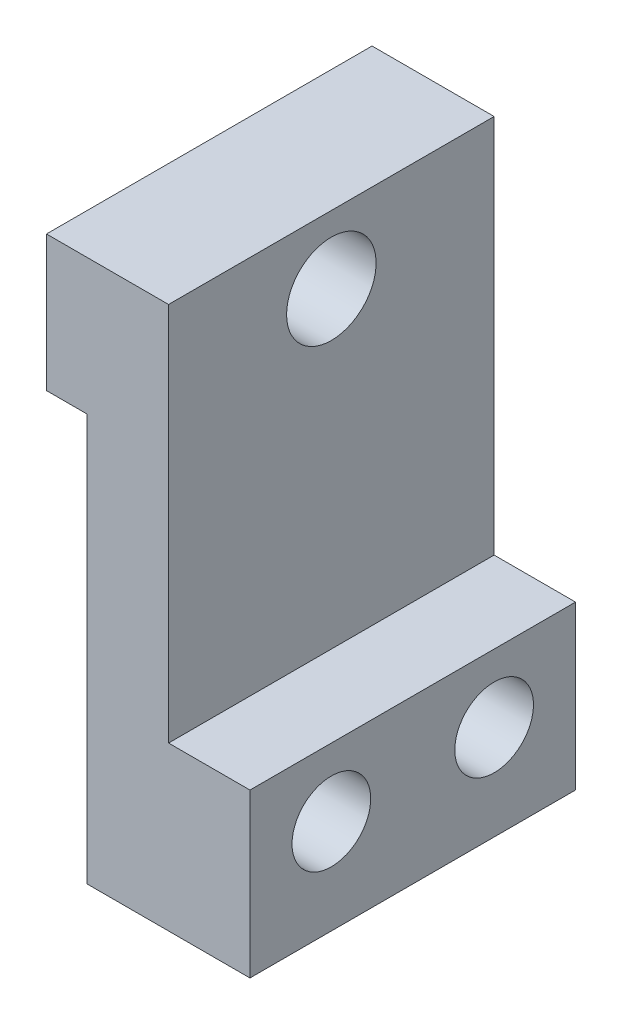
from build123d import *

# Parameters (mm, degrees)
BOSS_EXTRUDE1_DEPTH         = 12
M2_5_CLEARANCE_HOLE1_D      = 2.9
TAP_DRILL_FOR_M4X0_7_TAP1_D = 3.3


with BuildPart() as part:
    # Sketch1 → Boss-Extrude1 (new body)
    with BuildSketch(Plane.XY):
        Polygon((0, -6.868421053), (-6, -6.868421053), (-6, 8.131578947), (-7.5, 8.131578947), (-7.5, 13.131578947), (-3, 13.131578947), (-3, -0.868421053), (0, -0.868421053), align=None)
    extrude(amount=BOSS_EXTRUDE1_DEPTH)

    # M2.5 Clearance Hole1 (through all)
    with Locations(Plane.ZY.offset(6)):
        with Locations((3, -3.368421053), (9, -3.368421053)):
            Hole(M2_5_CLEARANCE_HOLE1_D / 2)

    # Tap Drill for M4x0.7 Tap1 (through all)
    with Locations(Plane.ZY.offset(7.5)):
        with Locations((6, 10.631578947)):
            Hole(TAP_DRILL_FOR_M4X0_7_TAP1_D / 2)


solid = part.part
